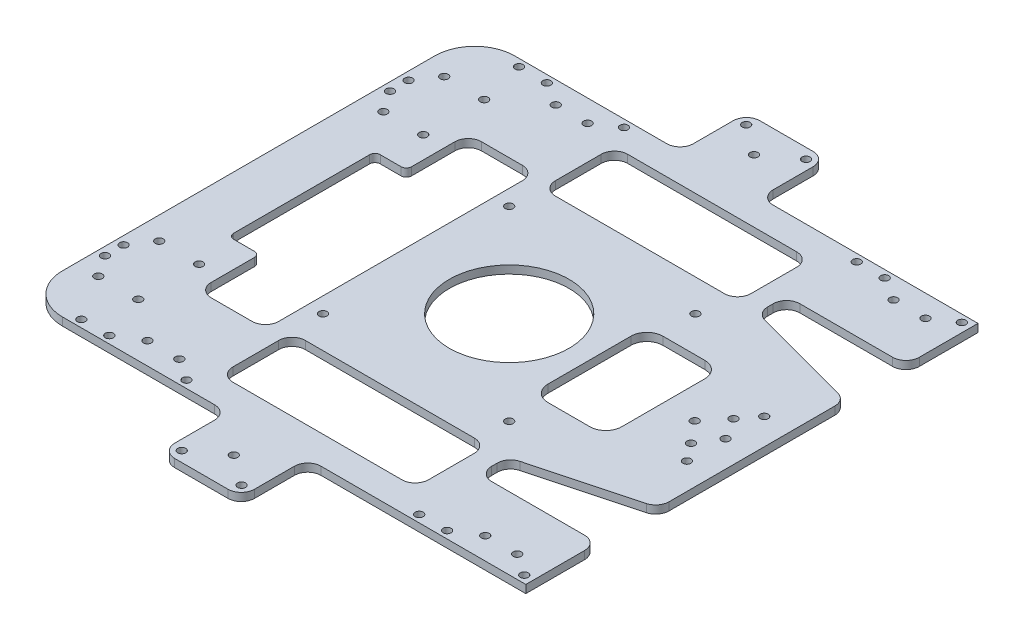
from build123d import *

# Parameters (mm, degrees)
SKETCH_1_R          = 1.5
SKETCH_1_R_2        = 22.5
SKETCH_1_W          = 25.382711005
SKETCH_1_H          = 101.626444412
SKETCH_1_W_2        = 73.520704478
SKETCH_1_H_2        = 27.206983468
SKETCH_1_W_3        = 27.767362264
SKETCH_1_H_3        = 43.217403646
EXTRUDE_1_DEPTH     = 3
FILLET_2_R          = 15
FILLET_3_R          = 15
SKETCH_2_R          = 1.5
CUT_EXTRUDE_1_DEPTH = 148.313428512
FILLET_6_R          = 5
FILLET_7_R          = 5
CUT_EXTRUDE_2_REACH = 149.313
SKETCH_3_R          = 1.5
FILLET_8_R          = 6
SKETCH_4_W          = 15.916712198
SKETCH_4_H          = 55.113170874
CUT_EXTRUDE_3_DEPTH = 148.313428512
FILLET_9_R          = 2
FILLET_10_R         = 2


with BuildPart() as part:
    # 草图1 → 凸台-拉伸1 (new body)
    with BuildSketch(Plane(origin=(0, 0, 0), x_dir=(1, 0, 0), z_dir=(0, 1, 0))):
        with BuildLine():
            Line((-91.25, 85), (-97.959535954, 85))
            Line((-97.959535954, 85), (-97.959535954, -85))
            Line((-97.959535954, -85), (-91.25, -85))
            Line((-91.25, -85), (-35.75, -85))
            Line((-35.75, -85), (-25.75, -85))
            ThreePointArc((-25.75, -85), (-22.214466094, -86.464466094), (-20.75, -90))
            Line((-20.75, -90), (-20.75, -104.982614697))
            ThreePointArc((-20.75, -104.982614697), (-19.285533906, -108.518148603), (-15.75, -109.982614697))
            Line((-15.75, -109.982614697), (4.25, -109.982614697))
            ThreePointArc((4.25, -109.982614697), (7.785533906, -108.518148603), (9.25, -104.982614697))
            Line((9.25, -104.982614697), (9.25, -90))
            ThreePointArc((9.25, -90), (10.714466094, -86.464466094), (14.25, -85))
            Line((14.25, -85), (44.25, -85))
            Line((44.25, -85), (91.25, -85))
            Line((91.25, -85), (91.25, -57.918235785))
            Line((91.25, -57.918235785), (46.355968051, -57.918235785))
            Line((46.355968051, -57.918235785), (46.355968051, -47.006199804))
            Line((46.355968051, -47.006199804), (91.25, -35))
            Line((91.25, -35), (91.25, 35))
            Line((91.25, 35), (46.355968051, 47.006199804))
            Line((46.355968051, 47.006199804), (46.355968051, 57.918235785))
            Line((46.355968051, 57.918235785), (91.25, 57.918235785))
            Line((91.25, 57.918235785), (91.25, 85))
            Line((91.25, 85), (44.25, 85))
            Line((44.25, 85), (14.25, 85))
            ThreePointArc((14.25, 85), (10.714466094, 86.464466094), (9.25, 90))
            Line((9.25, 90), (9.25, 104.982614697))
            ThreePointArc((9.25, 104.982614697), (7.785533906, 108.518148603), (4.25, 109.982614697))
            Line((4.25, 109.982614697), (-15.75, 109.982614697))
            ThreePointArc((-15.75, 109.982614697), (-19.285533906, 108.518148603), (-20.75, 104.982614697))
            Line((-20.75, 104.982614697), (-20.75, 90))
            ThreePointArc((-20.75, 90), (-22.214466094, 86.464466094), (-25.75, 85))
            Line((-25.75, 85), (-35.75, 85))
            Line((-35.75, 85), (-91.25, 85))
        make_face()
        with Locations(Location((-89.443571008, 65.02483454, 0), (0, 0, 270))):
            Circle(SKETCH_1_R, mode=Mode.SUBTRACT)
        with Locations(Location((-74.443571008, 65.02483454, 0), (0, 0, 270))):
            Circle(SKETCH_1_R, mode=Mode.SUBTRACT)
        with Locations(Location((-78.590757383, -82.25, 0), (0, 0, 270))):
            Circle(SKETCH_1_R, mode=Mode.SUBTRACT)
        with Locations(Location((-68.090757383, -82.25, 0), (0, 0, 270))):
            Circle(SKETCH_1_R, mode=Mode.SUBTRACT)
        with Locations(Location((-39.090757383, -82.25, 0), (0, 0, 270))):
            Circle(SKETCH_1_R, mode=Mode.SUBTRACT)
        with Locations(Location((48.409242617, -82.25, 0), (0, 0, 270))):
            Circle(SKETCH_1_R, mode=Mode.SUBTRACT)
        with Locations(Location((58.909242617, -82.25, 0), (0, 0, 270))):
            Circle(SKETCH_1_R, mode=Mode.SUBTRACT)
        with Locations(Location((87.909242617, -82.25, 0), (0, 0, 270))):
            Circle(SKETCH_1_R, mode=Mode.SUBTRACT)
        with Locations(Location((-78.590757383, 82.25, 0), (0, 0, 270))):
            Circle(SKETCH_1_R, mode=Mode.SUBTRACT)
        with Locations(Location((-68.090757383, 82.25, 0), (0, 0, 270))):
            Circle(SKETCH_1_R, mode=Mode.SUBTRACT)
        with Locations(Location((-39.090757383, 82.25, 0), (0, 0, 270))):
            Circle(SKETCH_1_R, mode=Mode.SUBTRACT)
        with Locations(Location((48.409242617, 82.25, 0), (0, 0, 270))):
            Circle(SKETCH_1_R, mode=Mode.SUBTRACT)
        with Locations(Location((58.909242617, 82.25, 0), (0, 0, 270))):
            Circle(SKETCH_1_R, mode=Mode.SUBTRACT)
        with Locations(Location((87.909242617, 82.25, 0), (0, 0, 270))):
            Circle(SKETCH_1_R, mode=Mode.SUBTRACT)
        with Locations(Location((-59.25, 76.75, 0), (0, 0, 270))):
            Circle(SKETCH_1_R, mode=Mode.SUBTRACT)
        with Locations(Location((-47.25, 76.75, 0), (0, 0, 270))):
            Circle(SKETCH_1_R, mode=Mode.SUBTRACT)
        with Locations(Location((-59.25, -76.75, 0), (0, 0, 270))):
            Circle(SKETCH_1_R, mode=Mode.SUBTRACT)
        with Locations(Location((-47.25, -76.75, 0), (0, 0, 270))):
            Circle(SKETCH_1_R, mode=Mode.SUBTRACT)
        with Locations(Location((67.75, 76.75, 0), (0, 0, 270))):
            Circle(SKETCH_1_R, mode=Mode.SUBTRACT)
        with Locations(Location((79.75, 76.75, 0), (0, 0, 270))):
            Circle(SKETCH_1_R, mode=Mode.SUBTRACT)
        with Locations(Location((67.75, -76.75, 0), (0, 0, 270))):
            Circle(SKETCH_1_R, mode=Mode.SUBTRACT)
        with Locations(Location((79.75, -76.75, 0), (0, 0, 270))):
            Circle(SKETCH_1_R, mode=Mode.SUBTRACT)
        with Locations(Location((-89.443571008, 42.133112371, 0), (0, 0, 270))):
            Circle(SKETCH_1_R, mode=Mode.SUBTRACT)
        with Locations(Location((-74.443571008, 42.133112371, 0), (0, 0, 270))):
            Circle(SKETCH_1_R, mode=Mode.SUBTRACT)
        with Locations(Location((-35, 35, 0), (0, 0, 270))):
            Circle(SKETCH_1_R, mode=Mode.SUBTRACT)
        with Locations(Location((-35, -35, 0), (0, 0, 90))):
            Circle(SKETCH_1_R, mode=Mode.SUBTRACT)
        with Locations(Location((35, -35, 0), (0, 0, 270))):
            Circle(SKETCH_1_R, mode=Mode.SUBTRACT)
        with Locations(Location((35, 35, 0), (0, 0, 90))):
            Circle(SKETCH_1_R, mode=Mode.SUBTRACT)
        with Locations(Location((-5.75, -97.789393477, 0), (0, 0, 270))):
            Circle(SKETCH_1_R, mode=Mode.SUBTRACT)
        with Locations(Location((-17, -106.1, 0), (0, 0, 270))):
            Circle(SKETCH_1_R, mode=Mode.SUBTRACT)
        with Locations(Location((5.5, -106.1, 0), (0, 0, 270))):
            Circle(SKETCH_1_R, mode=Mode.SUBTRACT)
        with Locations(Location((5.5, 106.1, 0), (0, 0, 90))):
            Circle(SKETCH_1_R, mode=Mode.SUBTRACT)
        with Locations(Location((-17, 106.1, 0), (0, 0, 90))):
            Circle(SKETCH_1_R, mode=Mode.SUBTRACT)
        with Locations(Location((-5.75, 97.789393477, 0), (0, 0, 90))):
            Circle(SKETCH_1_R, mode=Mode.SUBTRACT)
        with Locations(Location((0, 0, 0), (0, 0, 270))):
            Circle(SKETCH_1_R_2, mode=Mode.SUBTRACT)
        with Locations(Location((-74.443571008, -42.133112371, 0), (0, 0, 90))):
            Circle(SKETCH_1_R, mode=Mode.SUBTRACT)
        with Locations(Location((-89.443571008, -42.133112371, 0), (0, 0, 90))):
            Circle(SKETCH_1_R, mode=Mode.SUBTRACT)
        with Locations(Location((-74.443571008, -65.02483454, 0), (0, 0, 90))):
            Circle(SKETCH_1_R, mode=Mode.SUBTRACT)
        with Locations(Location((-89.443571008, -65.02483454, 0), (0, 0, 90))):
            Circle(SKETCH_1_R, mode=Mode.SUBTRACT)
        with Locations((-53.537495084, 0)):
            Rectangle(SKETCH_1_W, SKETCH_1_H, mode=Mode.SUBTRACT)
        with Locations((2.120156715, -60.609691538)):
            Rectangle(SKETCH_1_W_2, SKETCH_1_H_2, mode=Mode.SUBTRACT)
        with Locations((2.120156715, 60.609691538)):
            Rectangle(SKETCH_1_W_2, SKETCH_1_H_2, mode=Mode.SUBTRACT)
        with Locations((44.056842955, 0)):
            Rectangle(SKETCH_1_W_3, SKETCH_1_H_3, mode=Mode.SUBTRACT)
    extrude(amount=EXTRUDE_1_DEPTH)

    # 圆角2
    fillet_2_edges = [part.edges().sort_by_distance(p)[0] for p in [
        (-97.959535954, 1.5, -85),
    ]]
    fillet(fillet_2_edges, radius=FILLET_2_R)

    # 圆角3
    fillet_3_edges = [part.edges().sort_by_distance(p)[0] for p in [
        (-97.959535954, 1.5, 85),
    ]]
    fillet(fillet_3_edges, radius=FILLET_3_R)

    # 草图2 → 切除-拉伸1 (cut, through all)
    with BuildSketch(Plane(origin=(0, 3, 0), x_dir=(1, 0, 0), z_dir=(0, 1, 0))):
        with Locations(Location((-94.88992508, 57.078973455, 0), (0, 0, 270))):
            Circle(SKETCH_2_R)
        with Locations(Location((-94.88992508, 50.078973455, 0), (0, 0, 270))):
            Circle(SKETCH_2_R)
        with Locations(Location((-94.88992508, -50.078973455, 0), (0, 0, 270))):
            Circle(SKETCH_2_R)
        with Locations(Location((-94.88992508, -57.078973455, 0), (0, 0, 270))):
            Circle(SKETCH_2_R)
    extrude(amount=-CUT_EXTRUDE_1_DEPTH, mode=Mode.SUBTRACT)

    # 圆角6
    fillet_6_edges = [part.edges().sort_by_distance(p)[0] for p in [
        (-40.846139581, 1.5, 50.813222206),
        (-40.846139581, 1.5, -50.813222206),
        (-66.228850586, 1.5, -50.813222206),
        (-66.228850586, 1.5, 50.813222206),
        (91.25, 1.5, -57.918235785),
        (46.355968051, 1.5, -57.918235785),
        (46.355968051, 1.5, -47.006199804),
        (91.25, 1.5, -35),
        (91.25, 1.5, 35),
        (46.355968051, 1.5, 47.006199804),
        (46.355968051, 1.5, 57.918235785),
        (91.25, 1.5, 57.918235785),
    ]]
    fillet(fillet_6_edges, radius=FILLET_6_R)

    # 圆角7
    fillet_7_edges = [part.edges().sort_by_distance(p)[0] for p in [
        (-34.640195524, 1.5, -74.213183272),
        (-34.640195524, 1.5, -47.006199804),
        (38.880508954, 1.5, -47.006199804),
        (38.880508954, 1.5, -74.213183272),
        (-34.640195524, 1.5, 47.006199804),
        (-34.640195524, 1.5, 74.213183272),
        (38.880508954, 1.5, 74.213183272),
        (38.880508954, 1.5, 47.006199804),
    ]]
    fillet(fillet_7_edges, radius=FILLET_7_R)

    # 草图3 → 切除-拉伸2 (cut, up to next)
    with BuildSketch(Plane(origin=(0, 3, 0), x_dir=(1, 0, 0), z_dir=(0, 1, 0)), mode=Mode.PRIVATE) as cut_extrude_2_sk1:
        with Locations(Location((81.362549907, 14.526154224, 0), (0, 0, 270))):
            Circle(SKETCH_3_R)
    cut_extrude_2_tool1 = extrude(cut_extrude_2_sk1.sketch, amount=-CUT_EXTRUDE_2_REACH, mode=Mode.PRIVATE) & part.part
    # 草图3 → 切除-拉伸2 (cut, up to next)
    with BuildSketch(Plane(origin=(0, 3, 0), x_dir=(1, 0, 0), z_dir=(0, 1, 0)), mode=Mode.PRIVATE) as cut_extrude_2_sk2:
        with Locations(Location((81.362549907, -14.526154224, 0), (0, 0, 270))):
            Circle(SKETCH_3_R)
    cut_extrude_2_tool2 = extrude(cut_extrude_2_sk2.sketch, amount=-CUT_EXTRUDE_2_REACH, mode=Mode.PRIVATE) & part.part
    # 草图3 → 切除-拉伸2 (cut, up to next)
    with BuildSketch(Plane(origin=(0, 3, 0), x_dir=(1, 0, 0), z_dir=(0, 1, 0)), mode=Mode.PRIVATE) as cut_extrude_2_sk3:
        with Locations(Location((76.342072613, -7.976309366, 0), (0, 0, 270))):
            Circle(SKETCH_3_R)
    cut_extrude_2_tool3 = extrude(cut_extrude_2_sk3.sketch, amount=-CUT_EXTRUDE_2_REACH, mode=Mode.PRIVATE) & part.part
    # 草图3 → 切除-拉伸2 (cut, up to next)
    with BuildSketch(Plane(origin=(0, 3, 0), x_dir=(1, 0, 0), z_dir=(0, 1, 0)), mode=Mode.PRIVATE) as cut_extrude_2_sk4:
        with Locations(Location((76.342072613, 7.976309366, 0), (0, 0, 270))):
            Circle(SKETCH_3_R)
    cut_extrude_2_tool4 = extrude(cut_extrude_2_sk4.sketch, amount=-CUT_EXTRUDE_2_REACH, mode=Mode.PRIVATE) & part.part
    # 草图3 → 切除-拉伸2 (cut, up to next)
    with BuildSketch(Plane(origin=(0, 3, 0), x_dir=(1, 0, 0), z_dir=(0, 1, 0)), mode=Mode.PRIVATE) as cut_extrude_2_sk5:
        with Locations(Location((81.362549907, 0, 0), (0, 0, 270))):
            Circle(SKETCH_3_R)
    cut_extrude_2_tool5 = extrude(cut_extrude_2_sk5.sketch, amount=-CUT_EXTRUDE_2_REACH, mode=Mode.PRIVATE) & part.part
    # 草图3 → 切除-拉伸2 (cut, up to next)
    with BuildSketch(Plane(origin=(0, 3, 0), x_dir=(1, 0, 0), z_dir=(0, 1, 0)), mode=Mode.PRIVATE) as cut_extrude_2_sk6:
        with Locations(Location((69.731720894, 0, 0), (0, 0, 270))):
            Circle(SKETCH_3_R)
    cut_extrude_2_tool6 = extrude(cut_extrude_2_sk6.sketch, amount=-CUT_EXTRUDE_2_REACH, mode=Mode.PRIVATE) & part.part
    add(cut_extrude_2_tool1.solids().sort_by_distance((81.36255, 3, -14.526154))[0], mode=Mode.SUBTRACT)
    add(cut_extrude_2_tool2.solids().sort_by_distance((81.36255, 3, 14.526154))[0], mode=Mode.SUBTRACT)
    add(cut_extrude_2_tool3.solids().sort_by_distance((76.342073, 3, 7.976309))[0], mode=Mode.SUBTRACT)
    add(cut_extrude_2_tool4.solids().sort_by_distance((76.342073, 3, -7.976309))[0], mode=Mode.SUBTRACT)
    add(cut_extrude_2_tool5.solids().sort_by_distance((81.36255, 3, 0))[0], mode=Mode.SUBTRACT)
    add(cut_extrude_2_tool6.solids().sort_by_distance((69.731721, 3, 0))[0], mode=Mode.SUBTRACT)

    # 圆角8
    fillet_8_edges = [part.edges().sort_by_distance(p)[0] for p in [
        (57.940524087, 1.5, 21.608701823),
        (57.940524087, 1.5, -21.608701823),
        (30.173161823, 1.5, -21.608701823),
        (30.173161823, 1.5, 21.608701823),
    ]]
    fillet(fillet_8_edges, radius=FILLET_8_R)

    # 草图4 → 切除-拉伸3 (cut, through all)
    with BuildSketch(Plane(origin=(0, 3, 0), x_dir=(1, 0, 0), z_dir=(0, 1, 0))):
        with Locations((-70.063199579, 0)):
            Rectangle(SKETCH_4_W, SKETCH_4_H)
    extrude(amount=-CUT_EXTRUDE_3_DEPTH, mode=Mode.SUBTRACT)

    # 圆角9
    fillet_9_edges = [part.edges().sort_by_distance(p)[0] for p in [
        (-78.021555678, 1.5, 27.556585437),
        (-78.021555678, 1.5, -27.556585437),
    ]]
    fillet(fillet_9_edges, radius=FILLET_9_R)

    # 圆角10
    fillet_10_edges = [part.edges().sort_by_distance(p)[0] for p in [
        (-66.228850586, 1.5, 27.556585437),
        (-66.228850586, 1.5, -27.556585437),
    ]]
    fillet(fillet_10_edges, radius=FILLET_10_R)


solid = part.part
